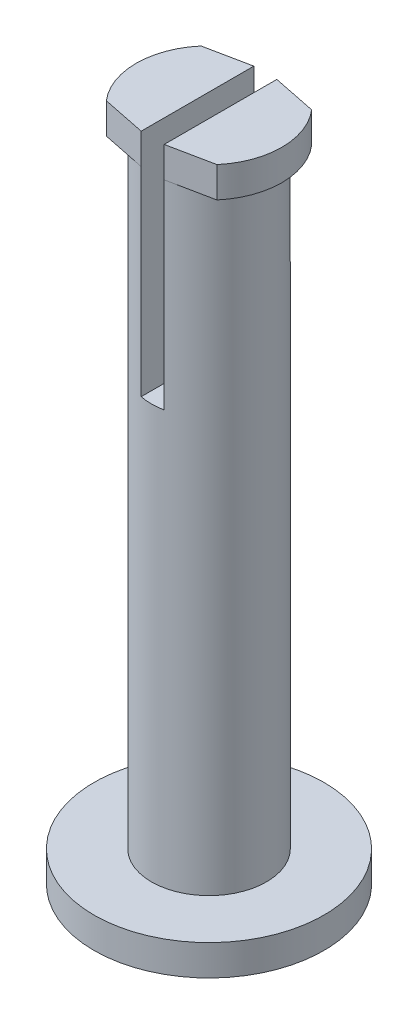
from build123d import *

# Parameters (mm, degrees)
SKETCH1_R           = 3.75
BOSS_EXTRUDE1_DEPTH = 1
SKETCH2_R           = 1.875
BOSS_EXTRUDE2_DEPTH = 20
SKETCH3_R           = 2.375
BOSS_EXTRUDE3_DEPTH = 1
SKETCH4_W           = 0.75
SKETCH4_H           = 8
CUT_EXTRUDE1_DEPTH  = 7.5
CUT_EXTRUDE2_START  = -10
CUT_EXTRUDE2_DEPTH  = 10


with BuildPart() as part:
    # Sketch1 → Boss-Extrude1 (new body)
    with BuildSketch(Plane(origin=(0, 0, 0), x_dir=(1, 0, 0), z_dir=(0, 1, 0))):
        with Locations(Location((0, 0, 0), (0, 0, 270))):
            Circle(SKETCH1_R)
    extrude(amount=BOSS_EXTRUDE1_DEPTH)

    # Sketch2 → Boss-Extrude2 (add)
    with BuildSketch(Plane(origin=(0, 1, 0), x_dir=(1, 0, 0), z_dir=(0, 1, 0))):
        with Locations(Location((0, 0, 0), (0, 0, 270))):
            Circle(SKETCH2_R)
    extrude(amount=BOSS_EXTRUDE2_DEPTH)

    # Sketch3 → Boss-Extrude3 (add)
    with BuildSketch(Plane(origin=(0, 21, 0), x_dir=(1, 0, 0), z_dir=(0, 1, 0))):
        with Locations(Location((0, 0, 0), (0, 0, 270))):
            Circle(SKETCH3_R)
    extrude(amount=BOSS_EXTRUDE3_DEPTH)

    # Sketch4 → Cut-Extrude1 (cut)
    with BuildSketch(Plane(origin=(0, 22, 0), x_dir=(1, 0, 0), z_dir=(0, 1, 0))):
        Rectangle(SKETCH4_W, SKETCH4_H)
    extrude(amount=-CUT_EXTRUDE1_DEPTH, mode=Mode.SUBTRACT)

    # Sketch5 → Cut-Extrude2 (cut)
    with BuildSketch(Plane(origin=(0, 22, 0), x_dir=(1, 0, 0), z_dir=(0, 1, 0)).offset(CUT_EXTRUDE2_START)):
        with BuildLine():
            Line((1.803285686, -1.545569712), (0.375, -1.837117307))
            Line((0.375, -1.837117307), (0.375, -2.34520788))
            ThreePointArc((0.375, -2.34520788), (1.160210081, -2.072326607), (1.803285686, -1.545569712))
        make_face()
        with BuildLine():
            Line((0.375, 2.34520788), (0.375, 1.837117307))
            Line((0.375, 1.837117307), (1.803285686, 1.545569712))
            ThreePointArc((1.803285686, 1.545569712), (1.160210081, 2.072326607), (0.375, 2.34520788))
        make_face()
        with BuildLine():
            Line((-1.803285686, 1.545569712), (-0.375, 1.837117307))
            Line((-0.375, 1.837117307), (-0.375, 2.34520788))
            ThreePointArc((-0.375, 2.34520788), (-1.160210081, 2.072326607), (-1.803285686, 1.545569712))
        make_face()
        with BuildLine():
            Line((-0.375, -2.34520788), (-0.375, -1.837117307))
            Line((-0.375, -1.837117307), (-1.803285686, -1.545569712))
            ThreePointArc((-1.803285686, -1.545569712), (-1.160210081, -2.072326607), (-0.375, -2.34520788))
        make_face()
    extrude(amount=CUT_EXTRUDE2_DEPTH, mode=Mode.SUBTRACT)


solid = part.part
